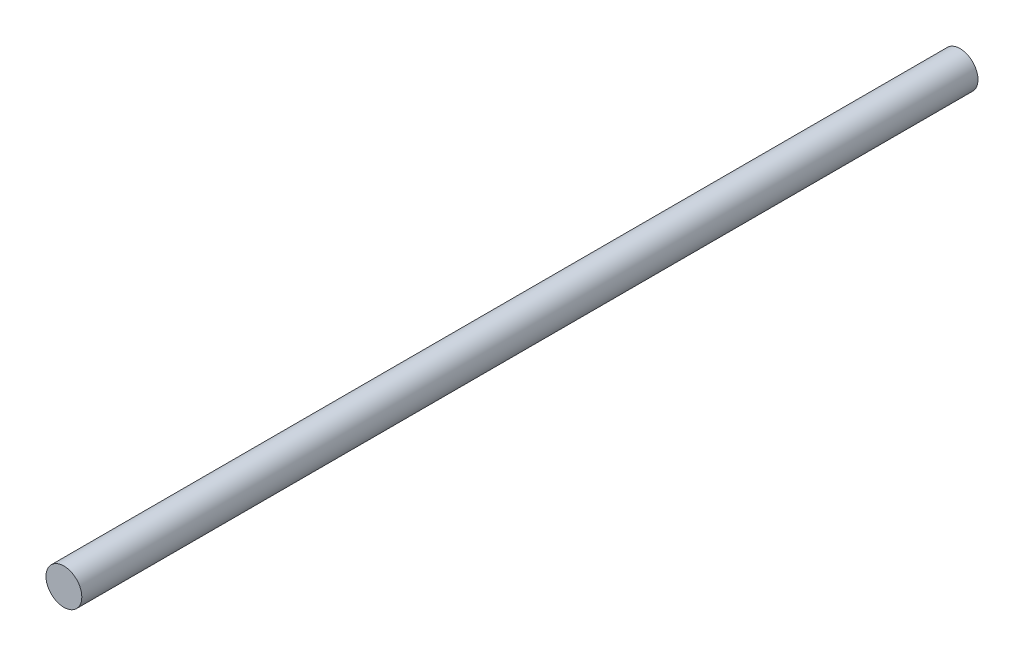
from build123d import *

# Parameters (mm, degrees)
SKETCH1_R           = 0.508
BOSS_EXTRUDE1_DEPTH = 25.4


with BuildPart() as part:
    # Sketch1 → Boss-Extrude1 (new body)
    with BuildSketch(Plane.XY):
        Circle(SKETCH1_R)
    extrude(amount=BOSS_EXTRUDE1_DEPTH)


solid = part.part
